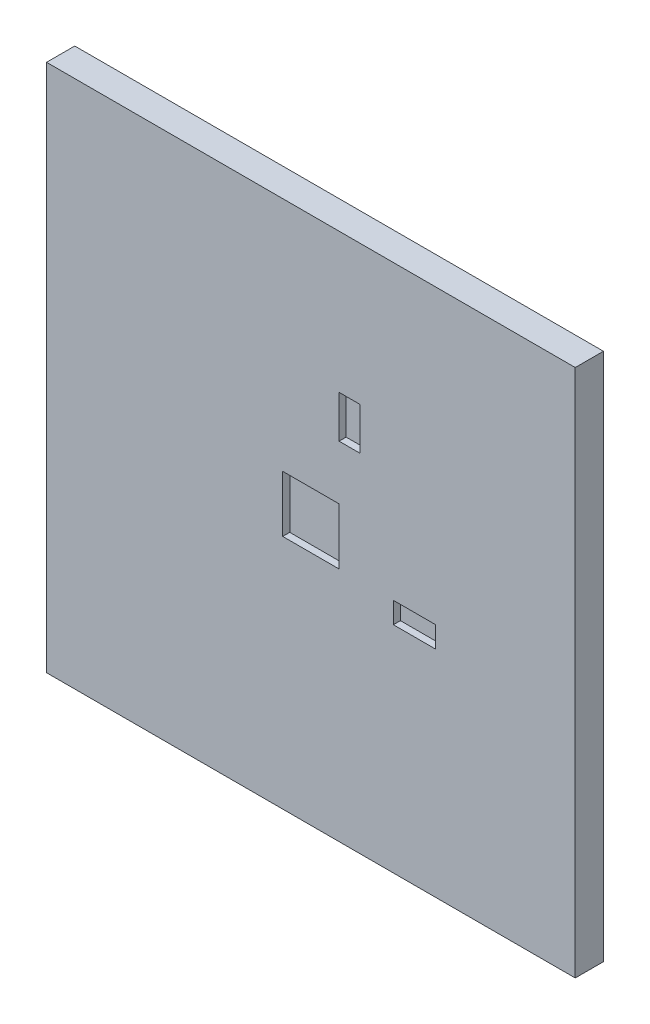
from build123d import *

# Parameters (mm, degrees)
SKETCH1_W           = 375
SKETCH1_H           = 375
BOSS_EXTRUDE1_DEPTH = 20
SKETCH2_W           = 15
SKETCH2_H           = 30
SKETCH2_W_2         = 30
SKETCH2_H_2         = 15
SKETCH2_W_3         = 40
SKETCH2_H_3         = 40
CUT_EXTRUDE1_DEPTH  = 5


with BuildPart() as part:
    # Sketch1 → Boss-Extrude1 (new body)
    with BuildSketch(Plane.XY):
        with Locations((-7.180851064, -95.212765957)):
            Rectangle(SKETCH1_W, SKETCH1_H)
    extrude(amount=BOSS_EXTRUDE1_DEPTH)

    # Sketch2 → Cut-Extrude1 (cut)
    with BuildSketch(Plane.XY.offset(20)):
        with Locations((20.319148936, -21.712765957)):
            Rectangle(SKETCH2_W, SKETCH2_H)
        with Locations((66.319148936, -122.712765957)):
            Rectangle(SKETCH2_W_2, SKETCH2_H_2)
        with Locations((-7.180851064, -95.212765957)):
            Rectangle(SKETCH2_W_3, SKETCH2_H_3)
    extrude(amount=-CUT_EXTRUDE1_DEPTH, mode=Mode.SUBTRACT)


solid = part.part
